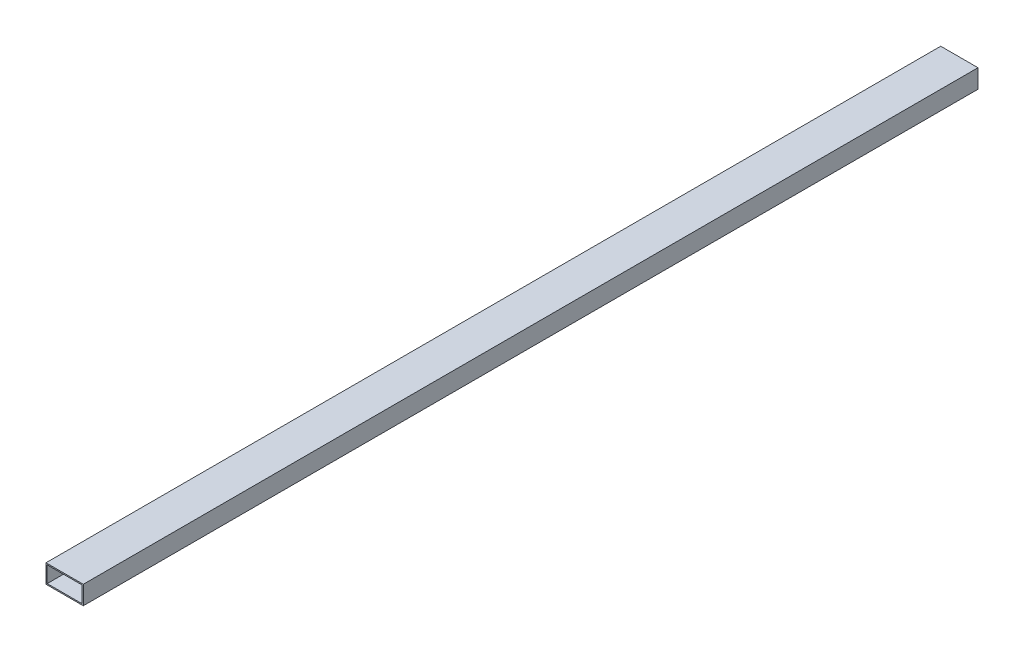
from build123d import *

# Parameters (mm, degrees)
SKETCH1_W           = 50.8
SKETCH1_H           = 25.4
SKETCH1_W_2         = 47.498
SKETCH1_H_2         = 22.098
BOSS_EXTRUDE1_DEPTH = 1219.2


with BuildPart() as part:
    # Sketch1 → Boss-Extrude1 (new body)
    with BuildSketch(Plane.XY):
        with Locations((25.4, 12.7)):
            Rectangle(SKETCH1_W, SKETCH1_H)
        with Locations((25.4, 12.7)):
            Rectangle(SKETCH1_W_2, SKETCH1_H_2, mode=Mode.SUBTRACT)
    extrude(amount=BOSS_EXTRUDE1_DEPTH)


solid = part.part
